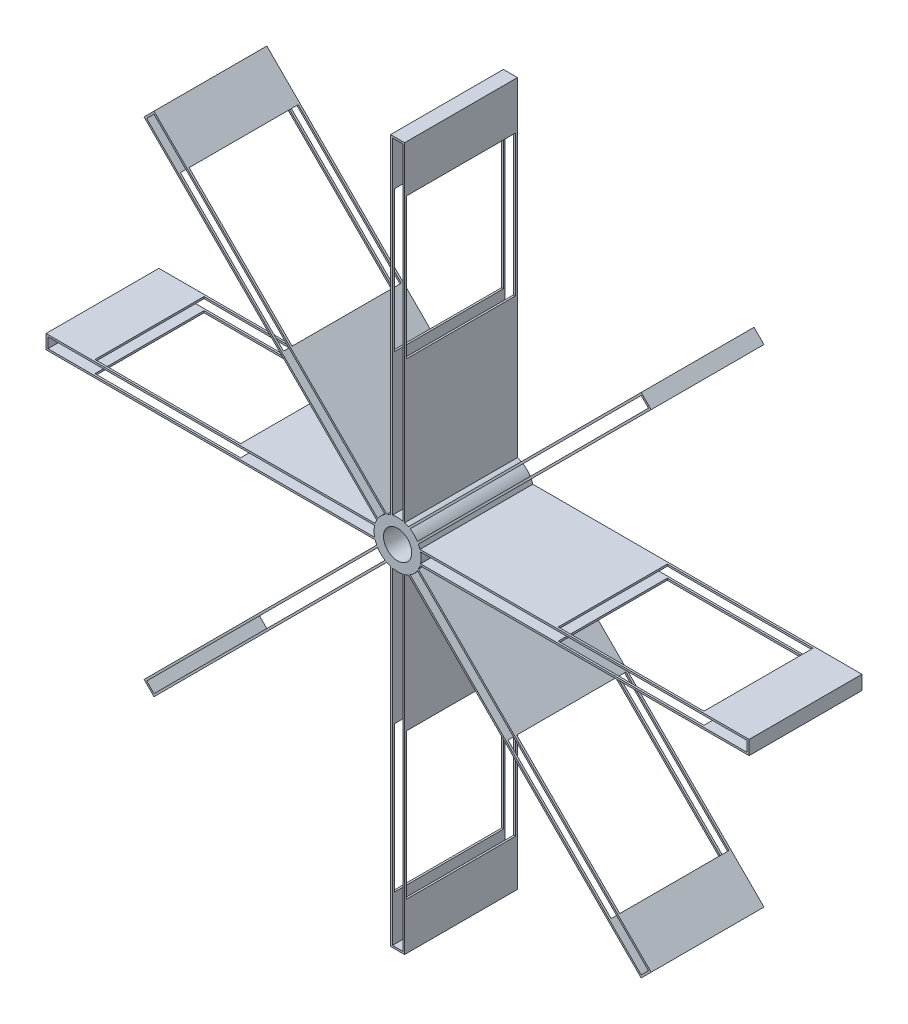
from build123d import *

# Parameters (mm, degrees)
SKETCH1_R           = 25
BOSS_EXTRUDE1_DEPTH = 120
BOSS_EXTRUDE3_DEPTH = 120
SKETCH5_W           = 116
SKETCH5_H           = 155
CUT_EXTRUDE1_DEPTH  = 20
SKETCH6_W           = 116
SKETCH6_H           = 150
CUT_EXTRUDE2_DEPTH  = 20
SKETCH7_W           = 116
SKETCH7_H           = 155
CUT_EXTRUDE3_DEPTH  = 20
SKETCH8_W           = 155
SKETCH8_H           = 116
CUT_EXTRUDE4_DEPTH  = 20
SKETCH9_W           = 114
SKETCH9_H           = 155
CUT_EXTRUDE5_DEPTH  = 20
SKETCH10_W          = 155
SKETCH10_H          = 116
CUT_EXTRUDE6_DEPTH  = 20
SKETCH12_W          = 116
SKETCH12_H          = 155
CUT_EXTRUDE7_DEPTH  = 20
SKETCH13_W          = 116
SKETCH13_H          = 155
CUT_EXTRUDE8_DEPTH  = 20
SKETCH14_R          = 15
CUT_EXTRUDE11_DEPTH = 543.148846766


with BuildPart() as part:
    # Sketch1 → Boss-Extrude1 (new body)
    with BuildSketch(Plane.XY):
        Circle(SKETCH1_R)
    extrude(amount=BOSS_EXTRUDE1_DEPTH)

    # Sketch2 → Boss-Extrude3 (add)
    with BuildSketch(Plane.XY):
        with BuildLine():
            Line((11.560121095, 22.166722813), (259.04749451, 269.654096228))
            Line((259.04749451, 269.654096228), (269.654096228, 259.04749451))
            Line((269.654096228, 259.04749451), (22.166722813, 11.560121095))
            ThreePointArc((22.166722813, 11.560121095), (23.096988313, 9.567085809), (23.848480035, 7.5))
            Line((23.848480035, 7.5), (373.848480035, 7.5))
            Line((373.848480035, 7.5), (373.848480035, -7.5))
            Line((373.848480035, -7.5), (23.848480035, -7.5))
            ThreePointArc((23.848480035, -7.5), (23.096988313, -9.567085809), (22.166722813, -11.560121095))
            Line((22.166722813, -11.560121095), (269.654096228, -259.04749451))
            Line((269.654096228, -259.04749451), (259.04749451, -269.654096228))
            Line((259.04749451, -269.654096228), (11.560121095, -22.166722813))
            ThreePointArc((11.560121095, -22.166722813), (9.567085809, -23.096988313), (7.5, -23.848480035))
            Line((7.5, -23.848480035), (7.5, -373.848480035))
            Line((7.5, -373.848480035), (-7.5, -373.848480035))
            Line((-7.5, -373.848480035), (-7.5, -23.848480035))
            ThreePointArc((-7.5, -23.848480035), (-9.567085809, -23.096988313), (-11.560121095, -22.166722813))
            Line((-11.560121095, -22.166722813), (-259.04749451, -269.654096228))
            Line((-259.04749451, -269.654096228), (-269.654096228, -259.04749451))
            Line((-269.654096228, -259.04749451), (-22.166722813, -11.560121095))
            ThreePointArc((-22.166722813, -11.560121095), (-23.096988313, -9.567085809), (-23.848480035, -7.5))
            Line((-23.848480035, -7.5), (-373.848480035, -7.5))
            Line((-373.848480035, -7.5), (-373.848480035, 7.5))
            Line((-373.848480035, 7.5), (-23.848480035, 7.5))
            ThreePointArc((-23.848480035, 7.5), (-23.096988313, 9.567085809), (-22.166722813, 11.560121095))
            Line((-22.166722813, 11.560121095), (-269.654096228, 259.04749451))
            Line((-269.654096228, 259.04749451), (-259.04749451, 269.654096228))
            Line((-259.04749451, 269.654096228), (-11.560121095, 22.166722813))
            ThreePointArc((-11.560121095, 22.166722813), (-9.567085809, 23.096988313), (-7.5, 23.848480035))
            Line((-7.5, 23.848480035), (-7.5, 373.848480035))
            Line((-7.5, 373.848480035), (7.5, 373.848480035))
            Line((7.5, 373.848480035), (7.5, 23.848480035))
            ThreePointArc((7.5, 23.848480035), (9.567085809, 23.096988313), (11.560121095, 22.166722813))
        make_face()
        with BuildLine():
            Line((259.04749451, 266.825669103), (13.355477064, 21.133651658))
            ThreePointArc((13.355477064, 21.133651658), (17.67766953, 17.67766953), (21.133651658, 13.355477064))
            Line((21.133651658, 13.355477064), (266.825669103, 259.04749451))
            Line((266.825669103, 259.04749451), (259.04749451, 266.825669103))
        make_face(mode=Mode.SUBTRACT)
        with BuildLine():
            Line((-5.5, 371.848480035), (5.5, 371.848480035))
            Line((5.5, 371.848480035), (5.5, 24.387496797))
            ThreePointArc((5.5, 24.387496797), (0, 25), (-5.5, 24.387496797))
            Line((-5.5, 24.387496797), (-5.5, 371.848480035))
        make_face(mode=Mode.SUBTRACT)
        with BuildLine():
            Line((371.848480035, 5.5), (24.387496797, 5.5))
            ThreePointArc((24.387496797, 5.5), (25, 0), (24.387496797, -5.5))
            Line((24.387496797, -5.5), (371.848480035, -5.5))
            Line((371.848480035, -5.5), (371.848480035, 5.5))
        make_face(mode=Mode.SUBTRACT)
        with BuildLine():
            Line((266.825669103, -259.04749451), (21.133651658, -13.355477064))
            ThreePointArc((21.133651658, -13.355477064), (17.67766953, -17.67766953), (13.355477064, -21.133651658))
            Line((13.355477064, -21.133651658), (259.04749451, -266.825669103))
            Line((259.04749451, -266.825669103), (266.825669103, -259.04749451))
        make_face(mode=Mode.SUBTRACT)
        with BuildLine():
            Line((5.5, -371.848480035), (5.5, -24.387496797))
            ThreePointArc((5.5, -24.387496797), (0, -25), (-5.5, -24.387496797))
            Line((-5.5, -24.387496797), (-5.5, -371.848480035))
            Line((-5.5, -371.848480035), (5.5, -371.848480035))
        make_face(mode=Mode.SUBTRACT)
        with BuildLine():
            Line((-259.04749451, -266.825669103), (-13.355477064, -21.133651658))
            ThreePointArc((-13.355477064, -21.133651658), (-17.67766953, -17.67766953), (-21.133651658, -13.355477064))
            Line((-21.133651658, -13.355477064), (-266.825669103, -259.04749451))
            Line((-266.825669103, -259.04749451), (-259.04749451, -266.825669103))
        make_face(mode=Mode.SUBTRACT)
        with BuildLine():
            Line((-371.848480035, -5.5), (-24.387496797, -5.5))
            ThreePointArc((-24.387496797, -5.5), (-25, 0), (-24.387496797, 5.5))
            Line((-24.387496797, 5.5), (-371.848480035, 5.5))
            Line((-371.848480035, 5.5), (-371.848480035, -5.5))
        make_face(mode=Mode.SUBTRACT)
        with BuildLine():
            Line((-266.825669103, 259.04749451), (-21.133651658, 13.355477064))
            ThreePointArc((-21.133651658, 13.355477064), (-17.67766953, 17.67766953), (-13.355477064, 21.133651658))
            Line((-13.355477064, 21.133651658), (-259.04749451, 266.825669103))
            Line((-259.04749451, 266.825669103), (-266.825669103, 259.04749451))
        make_face(mode=Mode.SUBTRACT)
    extrude(amount=BOSS_EXTRUDE3_DEPTH)

    # Sketch5 → Cut-Extrude1 (cut)
    with BuildSketch(Plane(origin=(5.303300859, 5.303300859, 0), x_dir=(0, 0, -1), z_dir=(0.7071067811865304, 0.7071067811865648, 0))):
        with Locations((-60, 246.348480035)):
            Rectangle(SKETCH5_W, SKETCH5_H)
    extrude(amount=-CUT_EXTRUDE1_DEPTH, mode=Mode.SUBTRACT)

    # Sketch6 → Cut-Extrude2 (cut)
    with BuildSketch(Plane.ZY.offset(7.5)):
        with Locations((60, 248.848480035)):
            Rectangle(SKETCH6_W, SKETCH6_H)
    extrude(amount=-CUT_EXTRUDE2_DEPTH, mode=Mode.SUBTRACT)

    # Sketch7 → Cut-Extrude3 (cut)
    with BuildSketch(Plane(origin=(5.303300859, -5.303300859, 0), x_dir=(0, 0, -1), z_dir=(0.7071067811865477, -0.7071067811865475, 0))):
        with Locations((-60, 246.348480035)):
            Rectangle(SKETCH7_W, SKETCH7_H)
    extrude(amount=-CUT_EXTRUDE3_DEPTH, mode=Mode.SUBTRACT)

    # Sketch8 → Cut-Extrude4 (cut)
    with BuildSketch(Plane.XZ.offset(7.5)):
        with Locations((-246.348480035, 60)):
            Rectangle(SKETCH8_W, SKETCH8_H)
    extrude(amount=-CUT_EXTRUDE4_DEPTH, mode=Mode.SUBTRACT)

    # Sketch9 → Cut-Extrude5 (cut)
    with BuildSketch(Plane(origin=(-5.303300859, 5.303300859, 0), x_dir=(0, 0, 1), z_dir=(-0.7071067811865476, 0.7071067811865476, 0))):
        with Locations((59, -246.348480035)):
            Rectangle(SKETCH9_W, SKETCH9_H)
    extrude(amount=-CUT_EXTRUDE5_DEPTH, mode=Mode.SUBTRACT)

    # Sketch10 → Cut-Extrude6 (cut)
    with BuildSketch(Plane.XZ.offset(7.5)):
        with Locations((246.348480035, 60)):
            Rectangle(SKETCH10_W, SKETCH10_H)
    extrude(amount=-CUT_EXTRUDE6_DEPTH, mode=Mode.SUBTRACT)

    # Sketch12 → Cut-Extrude7 (cut)
    with BuildSketch(Plane.ZY.offset(7.5)):
        with Locations((60, -246.348480035)):
            Rectangle(SKETCH12_W, SKETCH12_H)
    extrude(amount=-CUT_EXTRUDE7_DEPTH, mode=Mode.SUBTRACT)

    # Sketch13 → Cut-Extrude8 (cut)
    with BuildSketch(Plane(origin=(-5.303300859, -5.303300859, 0), x_dir=(0, 0, 1), z_dir=(-0.7071067811865477, -0.7071067811865475, 0))):
        with Locations((60, -246.348480035)):
            Rectangle(SKETCH13_W, SKETCH13_H)
    extrude(amount=-CUT_EXTRUDE8_DEPTH, mode=Mode.SUBTRACT)

    # Sketch14 → Cut-Extrude11 (cut, through all)
    with BuildSketch(Plane(origin=(0, 0, 0), x_dir=(-1, 0, 0), z_dir=(0, 0, -1))):
        Circle(SKETCH14_R)
    extrude(amount=-CUT_EXTRUDE11_DEPTH, mode=Mode.SUBTRACT)


solid = part.part
